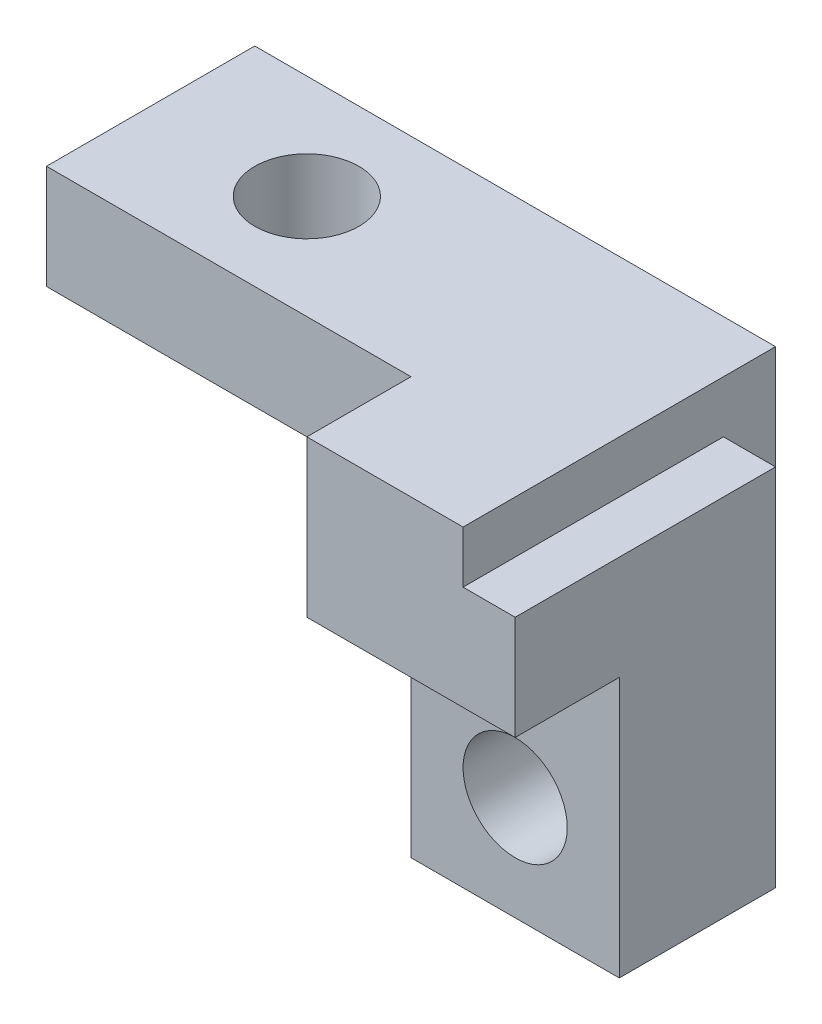
from build123d import *

# Parameters (mm, degrees)
BOSS_EXTRUDE1_DEPTH = 101.6
SKETCH6_R           = 12.7
CUT_EXTRUDE1_DEPTH  = 273.680564031
CUT_EXTRUDE5_DEPTH  = 285.565740427
SKETCH10_W          = 12.7
SKETCH10_H          = 12.7
CUT_EXTRUDE6_DEPTH  = 285.565740427
SKETCH11_W          = 25.4
SKETCH11_H          = 63.5
CUT_EXTRUDE7_DEPTH  = 206.591976072
CUT_EXTRUDE10_START = -25.4
SKETCH12_R          = 12.7
CUT_EXTRUDE10_DEPTH = 35.56


with BuildPart() as part:
    # Sketch5 → Boss-Extrude1 (new body)
    with BuildSketch(Plane(origin=(0, 130.175, 0), x_dir=(-1, 0, 0), z_dir=(0, 1, 0))):
        Polygon((-241.3, 0), (-190.5, 0), (-190.5, -25.4), (-101.6, -25.4), (-101.6, -76.2), (-228.6, -76.2), (-228.6, -63.5), (-241.3, -63.5), align=None)
    extrude(amount=-BOSS_EXTRUDE1_DEPTH)

    # Sketch6 → Cut-Extrude1 (cut, through all)
    with BuildSketch(Plane(origin=(0, 130.175, 0), x_dir=(-1, 0, 0), z_dir=(0, 1, 0))):
        with Locations(Location((-139.7, -50.8, 0), (0, 0, 90))):
            Circle(SKETCH6_R)
    extrude(amount=-CUT_EXTRUDE1_DEPTH, mode=Mode.SUBTRACT)

    # Sketch8 → Cut-Extrude5 (cut, through all)
    with BuildSketch(Plane.XY):
        Polygon((190.5, 104.775), (139.7, 104.775), (127, 104.775), (101.6, 104.775), (101.6, 28.575), (190.5, 28.575), (190.5, 92.075), align=None)
    extrude(amount=-CUT_EXTRUDE5_DEPTH, mode=Mode.SUBTRACT)

    # Sketch10 → Cut-Extrude6 (cut, through all)
    with BuildSketch(Plane.XY):
        with Locations((234.95, 123.825)):
            Rectangle(SKETCH10_W, SKETCH10_H)
    extrude(amount=-CUT_EXTRUDE6_DEPTH, mode=Mode.SUBTRACT)

    # Sketch11 → Cut-Extrude7 (cut, through all)
    with BuildSketch(Plane(origin=(241.3, 0, 0), x_dir=(0, 0, -1), z_dir=(1, 0, 0))):
        with Locations((12.7, 60.325)):
            Rectangle(SKETCH11_W, SKETCH11_H)
    extrude(amount=-CUT_EXTRUDE7_DEPTH, mode=Mode.SUBTRACT)

    # Sketch12 → Cut-Extrude10 (cut)
    with BuildSketch(Plane.XY.offset(CUT_EXTRUDE10_START)):
        with Locations((215.9, 53.975)):
            Circle(SKETCH12_R)
    extrude(amount=-CUT_EXTRUDE10_DEPTH, mode=Mode.SUBTRACT)


solid = part.part
